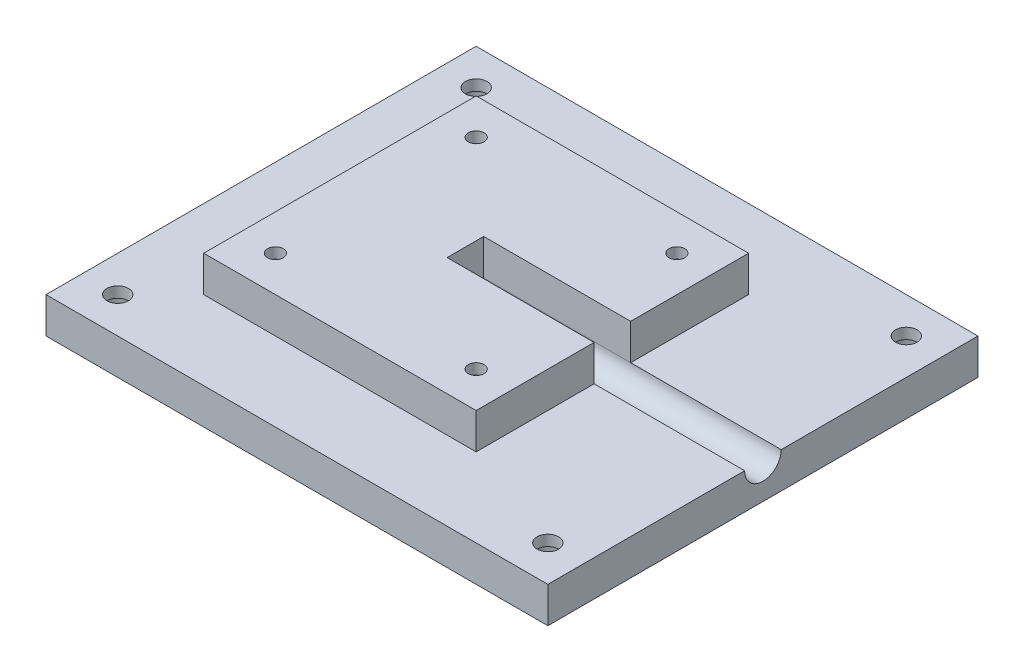
from build123d import *

# Parameters (mm, degrees)
SKETCH_1_W          = 70
SKETCH_1_H          = 60
EXTRUDE_1_DEPTH     = 5
SKETCH_2_W          = 38
SKETCH_2_H          = 38
EXTRUDE_2_DEPTH     = 5
CUT_EXTRUDE_1_REACH = 49.17
SKETCH_3_R          = 1.1
SKETCH_4_R          = 3
CUT_EXTRUDE_2_DEPTH = 8.5
CUT_EXTRUDE_3_REACH = 48.368
SKETCH_5_R          = 1.5
SKETCH_6_R          = 3
CUT_EXTRUDE_4_DEPTH = 3.5
CUT_EXTRUDE_5_DEPTH = 41.5


with BuildPart() as part:
    # 草图1 → 凸台-拉伸1 (new body)
    with BuildSketch(Plane(origin=(0, 0, 0), x_dir=(1, 0, 0), z_dir=(0, 1, 0))):
        Rectangle(SKETCH_1_W, SKETCH_1_H)
    extrude(amount=EXTRUDE_1_DEPTH)

    # 草图2 → 凸台-拉伸2 (add)
    with BuildSketch(Plane(origin=(0, 5, 0), x_dir=(1, 0, 0), z_dir=(0, 1, 0))):
        with Locations((-5, 0)):
            Rectangle(SKETCH_2_W, SKETCH_2_H)
    extrude(amount=EXTRUDE_2_DEPTH)

    # 草图3 → 切除-拉伸1 (cut, up to next)
    with BuildSketch(Plane(origin=(0, 10, 0), x_dir=(1, 0, 0), z_dir=(0, 1, 0)), mode=Mode.PRIVATE) as cut_extrude_1_sk1:
        with Locations(Location((-19, 14, 0), (0, 0, 270))):
            Circle(SKETCH_3_R)
    cut_extrude_1_tool1 = extrude(cut_extrude_1_sk1.sketch, amount=-CUT_EXTRUDE_1_REACH, mode=Mode.PRIVATE) & part.part
    # 草图3 → 切除-拉伸1 (cut, up to next)
    with BuildSketch(Plane(origin=(0, 10, 0), x_dir=(1, 0, 0), z_dir=(0, 1, 0)), mode=Mode.PRIVATE) as cut_extrude_1_sk2:
        with Locations(Location((9, 14, 0), (0, 0, 270))):
            Circle(SKETCH_3_R)
    cut_extrude_1_tool2 = extrude(cut_extrude_1_sk2.sketch, amount=-CUT_EXTRUDE_1_REACH, mode=Mode.PRIVATE) & part.part
    # 草图3 → 切除-拉伸1 (cut, up to next)
    with BuildSketch(Plane(origin=(0, 10, 0), x_dir=(1, 0, 0), z_dir=(0, 1, 0)), mode=Mode.PRIVATE) as cut_extrude_1_sk3:
        with Locations(Location((-19, -14, 0), (0, 0, 270))):
            Circle(SKETCH_3_R)
    cut_extrude_1_tool3 = extrude(cut_extrude_1_sk3.sketch, amount=-CUT_EXTRUDE_1_REACH, mode=Mode.PRIVATE) & part.part
    # 草图3 → 切除-拉伸1 (cut, up to next)
    with BuildSketch(Plane(origin=(0, 10, 0), x_dir=(1, 0, 0), z_dir=(0, 1, 0)), mode=Mode.PRIVATE) as cut_extrude_1_sk4:
        with Locations(Location((9, -14, 0), (0, 0, 270))):
            Circle(SKETCH_3_R)
    cut_extrude_1_tool4 = extrude(cut_extrude_1_sk4.sketch, amount=-CUT_EXTRUDE_1_REACH, mode=Mode.PRIVATE) & part.part
    add(cut_extrude_1_tool1.solids().sort_by_distance((-19, 10, -14))[0], mode=Mode.SUBTRACT)
    add(cut_extrude_1_tool2.solids().sort_by_distance((9, 10, -14))[0], mode=Mode.SUBTRACT)
    add(cut_extrude_1_tool3.solids().sort_by_distance((-19, 10, 14))[0], mode=Mode.SUBTRACT)
    add(cut_extrude_1_tool4.solids().sort_by_distance((9, 10, 14))[0], mode=Mode.SUBTRACT)

    # 草图4 → 切除-拉伸2 (cut)
    with BuildSketch(Plane.XZ):
        with Locations(Location((-19, -14, 0), (0, 0, 270))):
            Circle(SKETCH_4_R)
        with Locations(Location((-19, 14, 0), (0, 0, 270))):
            Circle(SKETCH_4_R)
        with Locations(Location((9, 14, 0), (0, 0, 270))):
            Circle(SKETCH_4_R)
        with Locations(Location((9, -14, 0), (0, 0, 270))):
            Circle(SKETCH_4_R)
    extrude(amount=-CUT_EXTRUDE_2_DEPTH, mode=Mode.SUBTRACT)

    # 草图5 → 切除-拉伸3 (cut, up to next)
    with BuildSketch(Plane(origin=(0, 5, 0), x_dir=(1, 0, 0), z_dir=(0, 1, 0)), mode=Mode.PRIVATE) as cut_extrude_3_sk1:
        with Locations(Location((-30, 25, 0), (0, 0, 270))):
            Circle(SKETCH_5_R)
    cut_extrude_3_tool1 = extrude(cut_extrude_3_sk1.sketch, amount=-CUT_EXTRUDE_3_REACH, mode=Mode.PRIVATE) & part.part
    # 草图5 → 切除-拉伸3 (cut, up to next)
    with BuildSketch(Plane(origin=(0, 5, 0), x_dir=(1, 0, 0), z_dir=(0, 1, 0)), mode=Mode.PRIVATE) as cut_extrude_3_sk2:
        with Locations(Location((30, 25, 0), (0, 0, 270))):
            Circle(SKETCH_5_R)
    cut_extrude_3_tool2 = extrude(cut_extrude_3_sk2.sketch, amount=-CUT_EXTRUDE_3_REACH, mode=Mode.PRIVATE) & part.part
    # 草图5 → 切除-拉伸3 (cut, up to next)
    with BuildSketch(Plane(origin=(0, 5, 0), x_dir=(1, 0, 0), z_dir=(0, 1, 0)), mode=Mode.PRIVATE) as cut_extrude_3_sk3:
        with Locations(Location((30, -25, 0), (0, 0, 270))):
            Circle(SKETCH_5_R)
    cut_extrude_3_tool3 = extrude(cut_extrude_3_sk3.sketch, amount=-CUT_EXTRUDE_3_REACH, mode=Mode.PRIVATE) & part.part
    # 草图5 → 切除-拉伸3 (cut, up to next)
    with BuildSketch(Plane(origin=(0, 5, 0), x_dir=(1, 0, 0), z_dir=(0, 1, 0)), mode=Mode.PRIVATE) as cut_extrude_3_sk4:
        with Locations(Location((-30, -25, 0), (0, 0, 270))):
            Circle(SKETCH_5_R)
    cut_extrude_3_tool4 = extrude(cut_extrude_3_sk4.sketch, amount=-CUT_EXTRUDE_3_REACH, mode=Mode.PRIVATE) & part.part
    add(cut_extrude_3_tool1.solids().sort_by_distance((-30, 5, -25))[0], mode=Mode.SUBTRACT)
    add(cut_extrude_3_tool2.solids().sort_by_distance((30, 5, -25))[0], mode=Mode.SUBTRACT)
    add(cut_extrude_3_tool3.solids().sort_by_distance((30, 5, 25))[0], mode=Mode.SUBTRACT)
    add(cut_extrude_3_tool4.solids().sort_by_distance((-30, 5, 25))[0], mode=Mode.SUBTRACT)

    # 草图6 → 切除-拉伸4 (cut)
    with BuildSketch(Plane.XZ):
        with Locations(Location((-30, -25, 0), (0, 0, 270))):
            Circle(SKETCH_6_R)
        with Locations(Location((30, -25, 0), (0, 0, 270))):
            Circle(SKETCH_6_R)
        with Locations(Location((30, 25, 0), (0, 0, 270))):
            Circle(SKETCH_6_R)
        with Locations(Location((-30, 25, 0), (0, 0, 270))):
            Circle(SKETCH_6_R)
    extrude(amount=-CUT_EXTRUDE_4_DEPTH, mode=Mode.SUBTRACT)

    # 草图7 → 切除-拉伸5 (cut)
    with BuildSketch(Plane(origin=(35, 0, 0), x_dir=(0, 0, -1), z_dir=(1, 0, 0))):
        with BuildLine():
            Line((2.55, 5), (2.55, 10))
            Line((2.55, 10), (-2.55, 10))
            Line((-2.55, 10), (-2.55, 5))
            ThreePointArc((-2.55, 5), (0, 2.45), (2.55, 5))
        make_face()
    extrude(amount=-CUT_EXTRUDE_5_DEPTH, mode=Mode.SUBTRACT)


solid = part.part
